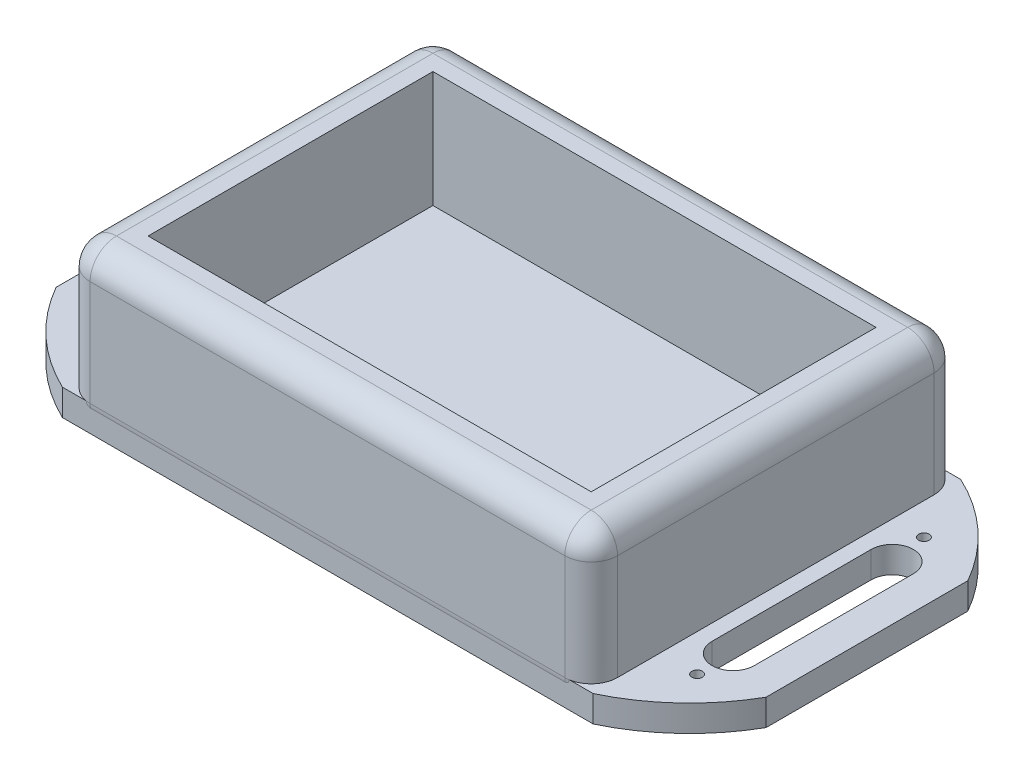
from build123d import *

# Parameters (mm, degrees)
BOSS_EXTRUDE2_DEPTH = 15
FILLET2_R           = 2.5
SKETCH3_R           = 0.5
BOSS_EXTRUDE4_DEPTH = 2.5
SKETCH4_W           = 42.002754972
SKETCH4_H           = 27.001036704
CUT_EXTRUDE2_DEPTH  = 11


with BuildPart() as part:
    # Sketch1 → Boss-Extrude2 (new body)
    with BuildSketch(Plane(origin=(0, 0, 0), x_dir=(1, 0, 0), z_dir=(0, 1, 0))):
        with BuildLine():
            Line((-23.383883476, 16.616116524), (21.616116524, 16.616116524))
            ThreePointArc((21.616116524, 16.616116524), (23.383883476, 15.883883476), (24.116116524, 14.116116524))
            Line((24.116116524, 14.116116524), (24.116116524, -15.883883476))
            ThreePointArc((24.116116524, -15.883883476), (23.383883476, -17.651650429), (21.616116524, -18.383883476))
            Line((21.616116524, -18.383883476), (-23.383883476, -18.383883476))
            ThreePointArc((-23.383883476, -18.383883476), (-25.151650429, -17.651650429), (-25.883883476, -15.883883476))
            Line((-25.883883476, -15.883883476), (-25.883883476, 14.116116524))
            ThreePointArc((-25.883883476, 14.116116524), (-25.151650429, 15.883883476), (-23.383883476, 16.616116524))
        make_face()
    extrude(amount=BOSS_EXTRUDE2_DEPTH)

    # Fillet2
    fillet2_edges = [part.edges().sort_by_distance(p)[0] for p in [
        (-25.151650429, 15, 17.651650429),
        (-25.883883476, 0, 0.883883476),
        (-25.151650429, 0, -15.883883476),
        (-0.883883476, 15, 18.383883476),
        (23.383883476, 15, 17.651650429),
        (24.116116524, 15, 0.883883476),
        (23.383883476, 15, -15.883883476),
        (-0.883883476, 15, -16.616116524),
        (-25.151650429, 15, -15.883883476),
        (-25.883883476, 15, 0.883883476),
        (-0.883883476, 0, -16.616116524),
        (23.383883476, 0, -15.883883476),
        (24.116116524, 0, 0.883883476),
        (23.383883476, 0, 17.651650429),
        (-0.883883476, 0, 18.383883476),
        (-25.151650429, 0, 17.651650429),
    ]]
    fillet(fillet2_edges, radius=FILLET2_R)

    # Sketch3 → Boss-Extrude4 (add)
    with BuildSketch(Plane(origin=(0, 0, 0), x_dir=(1, 0, 0), z_dir=(0, 1, 0))):
        with BuildLine():
            Line((-25.883883476, 16.646945133), (24.116116524, 16.646945133))
            ThreePointArc((24.116116524, 16.646945133), (29.061870418, 13.334132498), (32.766116524, 8.674328862))
            Line((32.766116524, 8.674328862), (32.766116524, -10.453501419))
            ThreePointArc((32.766116524, -10.453501419), (29.124788001, -15.055056138), (24.271254893, -18.353054867))
            Line((24.271254893, -18.353054867), (-26.039021846, -18.353054867))
            ThreePointArc((-26.039021846, -18.353054867), (-30.892554954, -15.055056138), (-34.533883476, -10.453501419))
            Line((-34.533883476, -10.453501419), (-34.533883476, 8.674328862))
            ThreePointArc((-34.533883476, 8.674328862), (-30.829637371, 13.334132498), (-25.883883476, 16.646945133))
        make_face()
        with Locations(Location((-28.883883476, 10.158483361, 0), (0, 0, 270))):
            Circle(SKETCH3_R, mode=Mode.SUBTRACT)
        with Locations(Location((-29.383883476, -11.841516639, 0), (0, 0, 270))):
            Circle(SKETCH3_R, mode=Mode.SUBTRACT)
        with Locations(Location((27.616116524, -11.841516639, 0), (0, 0, 270))):
            Circle(SKETCH3_R, mode=Mode.SUBTRACT)
        with Locations(Location((27.116116524, 10.158483361, 0), (0, 0, 270))):
            Circle(SKETCH3_R, mode=Mode.SUBTRACT)
        with BuildLine():
            Line((29.616116524, 6.658483361), (29.616116524, -8.426250314))
            ThreePointArc((29.616116524, -8.426250314), (27.616116524, -10.426250314), (25.616116524, -8.426250314))
            Line((25.616116524, -8.426250314), (25.616116524, 6.658483361))
            ThreePointArc((25.616116524, 6.658483361), (27.616116524, 8.658483361), (29.616116524, 6.658483361))
        make_face(mode=Mode.SUBTRACT)
        with BuildLine():
            Line((-31.383883476, 6.658483361), (-31.383883476, -8.426250314))
            ThreePointArc((-31.383883476, -8.426250314), (-29.383883476, -10.426250314), (-27.383883476, -8.426250314))
            Line((-27.383883476, -8.426250314), (-27.383883476, 6.658483361))
            ThreePointArc((-27.383883476, 6.658483361), (-29.383883476, 8.658483361), (-31.383883476, 6.658483361))
        make_face(mode=Mode.SUBTRACT)
    extrude(amount=BOSS_EXTRUDE4_DEPTH)

    # Sketch4 → Cut-Extrude2 (cut)
    with BuildSketch(Plane(origin=(0, 15, 0), x_dir=(1, 0, 0), z_dir=(0, 1, 0))):
        with Locations((-0.88269634, -0.884055652)):
            Rectangle(SKETCH4_W, SKETCH4_H)
    extrude(amount=-CUT_EXTRUDE2_DEPTH, mode=Mode.SUBTRACT)


solid = part.part
